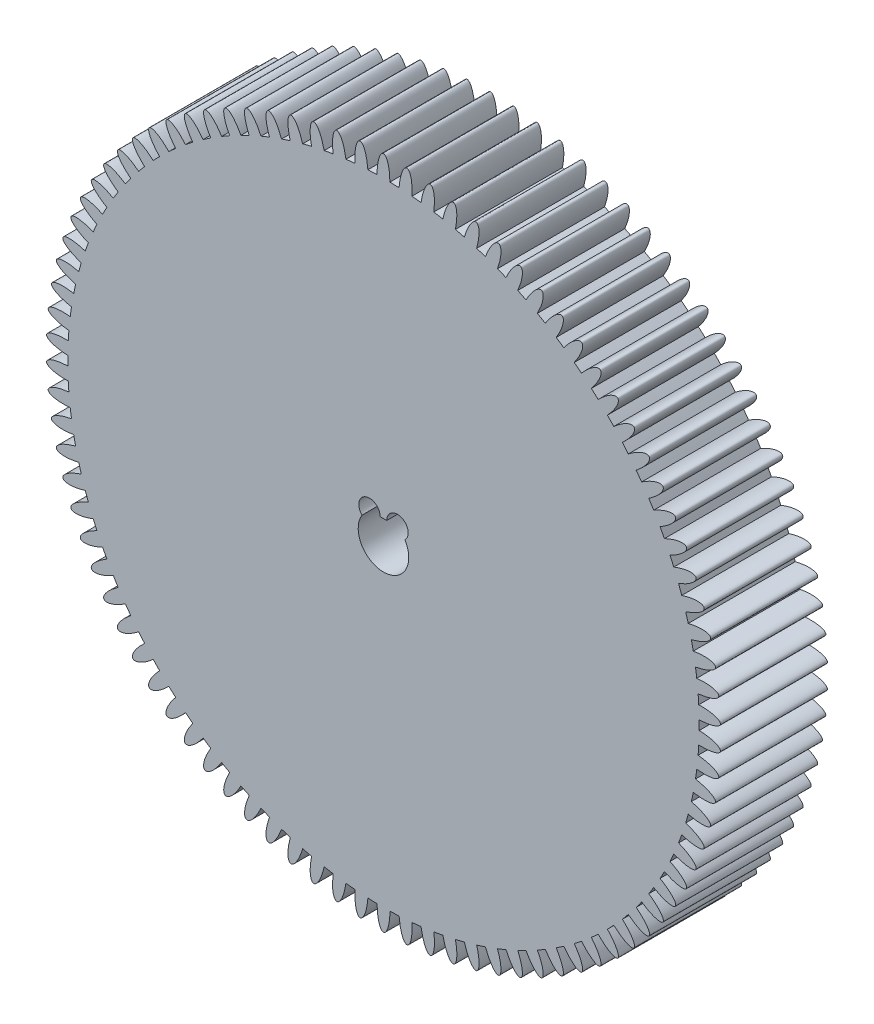
from build123d import *

# Parameters (mm, degrees)
SKETCH1_R               = 37.465
BOSS_EXTRUDE1_DEPTH     = 6.35
CUT_EXTRUDE1_DEPTH      = 55.484332152
CUT_EXTRUDE1_DEPTH_BACK = 55.484332152
CUT_EXTRUDE2_DEPTH      = 55.484332152
CUT_EXTRUDE2_DEPTH_BACK = 55.484332152
SKETCH3_R               = 1.27
SKETCH5_RX              = 2.54
SKETCH5_RY              = 0.762
BOSS_EXTRUDE2_DEPTH     = 12.7
CIRPATTERN1_COUNT       = 90


with BuildPart() as part:
    # Sketch1 → Boss-Extrude1 (new, symmetric)
    with BuildSketch(Plane.XY):
        Circle(SKETCH1_R)
    extrude(amount=BOSS_EXTRUDE1_DEPTH, both=True)

    # Sketch2 → Cut-Extrude1 (cut, two sides: drawn at the far end of the back side and taken through both)
    with BuildSketch(Plane.XY.offset(6.35).offset(-CUT_EXTRUDE1_DEPTH_BACK)):
        with BuildLine():
            Line((-1.658312448, 2.50000008), (1.658312448, 2.50000008))
            ThreePointArc((1.658312448, 2.50000008), (0, -3.000000096), (-1.658312448, 2.50000008))
        make_face()
    extrude(amount=CUT_EXTRUDE1_DEPTH + CUT_EXTRUDE1_DEPTH_BACK, mode=Mode.SUBTRACT)

    # Sketch3 → Cut-Extrude2 (cut, two sides: drawn at the far end of the back side and taken through both)
    with BuildSketch(Plane.XY.offset(6.35).offset(-CUT_EXTRUDE2_DEPTH_BACK)):
        with Locations((-1.658312448, 2.50000008)):
            Circle(SKETCH3_R)
        with Locations((1.658312448, 2.50000008)):
            Circle(SKETCH3_R)
    extrude(amount=CUT_EXTRUDE2_DEPTH + CUT_EXTRUDE2_DEPTH_BACK, mode=Mode.SUBTRACT)

    # Sketch5 → Boss-Extrude2 (add)
    with BuildSketch(Plane.XY.offset(6.35)):
        with Locations(Location((0, 37.465), (0, 0, 90))):
            Ellipse(SKETCH5_RX, SKETCH5_RY)
    boss_extrude2 = extrude(amount=-BOSS_EXTRUDE2_DEPTH)

    # CirPattern1: Boss-Extrude2 ×90 about axis
    cirpattern1_axis = Axis((0, 0, -6.35), (0, 0, 1))
    for i in range(1, CIRPATTERN1_COUNT):
        add(boss_extrude2.rotate(cirpattern1_axis, i * 360 / CIRPATTERN1_COUNT))


solid = part.part
